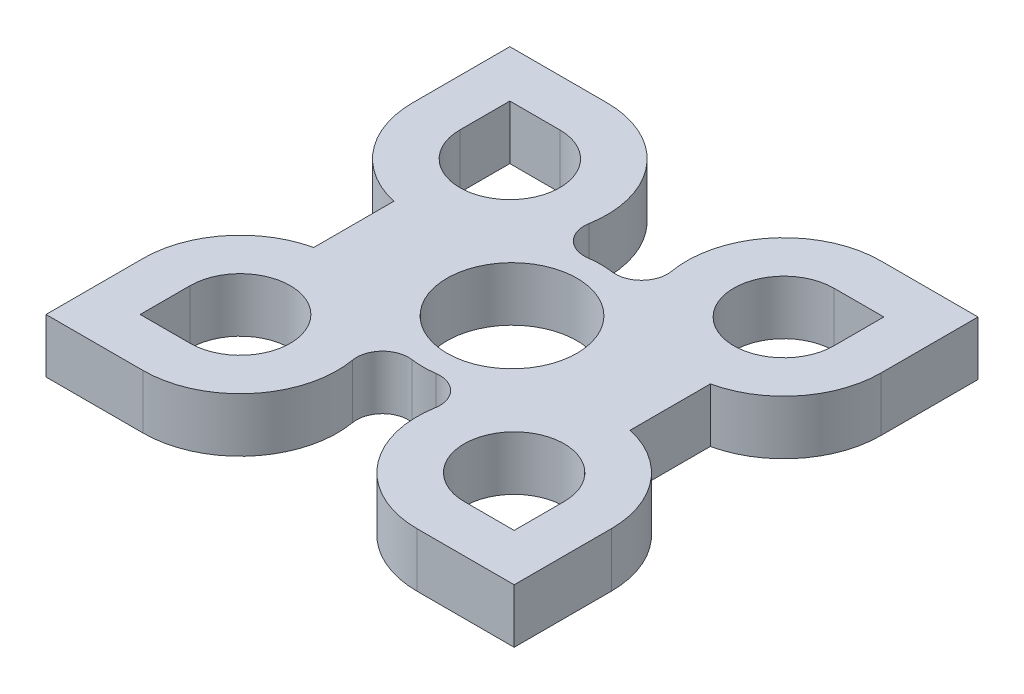
from build123d import *

# Parameters (mm, degrees)
SKETCH1_R           = 30
BOSS_EXTRUDE1_DEPTH = 25


with BuildPart() as part:
    # Sketch1 → Boss-Extrude1 (new body)
    with BuildSketch(Plane(origin=(0, 0, 0), x_dir=(1, 0, 0), z_dir=(0, 1, 0))):
        with BuildLine():
            Line((73, 18.485014011), (73, -18.485014011))
            ThreePointArc((73, -18.485014011), (98.171988791, -34.2), (108, -62.2))
            Line((108, -62.2), (108, -107))
            Line((108, -107), (63.2, -107))
            ThreePointArc((63.2, -107), (28.924287458, -91.048146036), (19.057555316, -54.552479005))
            ThreePointArc((19.057555316, -54.552479005), (15.86461811, -44.166949194), (5.59587046, -40.616329645))
            ThreePointArc((5.59587046, -40.616329645), (0, -41), (-5.59587046, -40.616329645))
            ThreePointArc((-5.59587046, -40.616329645), (-15.86461811, -44.166949194), (-19.057555316, -54.552479005))
            ThreePointArc((-19.057555316, -54.552479005), (-28.924287458, -91.048146036), (-63.2, -107))
            Line((-63.2, -107), (-108, -107))
            Line((-108, -107), (-108, -62.2))
            ThreePointArc((-108, -62.2), (-98.171988791, -34.2), (-73, -18.485014011))
            Line((-73, -18.485014011), (-73, 18.485014011))
            ThreePointArc((-73, 18.485014011), (-98.171988791, 34.2), (-108, 62.2))
            Line((-108, 62.2), (-108, 107))
            Line((-108, 107), (-63.2, 107))
            ThreePointArc((-63.2, 107), (-28.924287458, 91.048146036), (-19.057555316, 54.552479005))
            ThreePointArc((-19.057555316, 54.552479005), (-15.86461811, 44.166949194), (-5.59587046, 40.616329645))
            ThreePointArc((-5.59587046, 40.616329645), (0, 41), (5.59587046, 40.616329645))
            ThreePointArc((5.59587046, 40.616329645), (15.86461811, 44.166949194), (19.057555316, 54.552479005))
            ThreePointArc((19.057555316, 54.552479005), (28.924287458, 91.048146036), (63.2, 107))
            Line((63.2, 107), (108, 107))
            Line((108, 107), (108, 62.2))
            ThreePointArc((108, 62.2), (98.171988791, 34.2), (73, 18.485014011))
        make_face()
        with Locations(Location((0, 0, 0), (0, 0, 270))):
            Circle(SKETCH1_R, mode=Mode.SUBTRACT)
        with BuildLine():
            Line((86.274940548, 85.274940548), (86.274940548, 62.2))
            ThreePointArc((86.274940548, 62.2), (46.883553063, 45.883553063), (63.2, 85.274940548))
            Line((63.2, 85.274940548), (86.274940548, 85.274940548))
        make_face(mode=Mode.SUBTRACT)
        with BuildLine():
            Line((86.274940548, -85.274940548), (86.274940548, -62.2))
            ThreePointArc((86.274940548, -62.2), (46.883553063, -45.883553063), (63.2, -85.274940548))
            Line((63.2, -85.274940548), (86.274940548, -85.274940548))
        make_face(mode=Mode.SUBTRACT)
        with BuildLine():
            Line((-86.274940548, -85.274940548), (-86.274940548, -62.2))
            ThreePointArc((-86.274940548, -62.2), (-46.883553063, -45.883553063), (-63.2, -85.274940548))
            Line((-63.2, -85.274940548), (-86.274940548, -85.274940548))
        make_face(mode=Mode.SUBTRACT)
        with BuildLine():
            Line((-63.2, 85.274940548), (-86.274940548, 85.274940548))
            Line((-86.274940548, 85.274940548), (-86.274940548, 62.2))
            ThreePointArc((-86.274940548, 62.2), (-46.883553063, 45.883553063), (-63.2, 85.274940548))
        make_face(mode=Mode.SUBTRACT)
    extrude(amount=BOSS_EXTRUDE1_DEPTH)


solid = part.part
